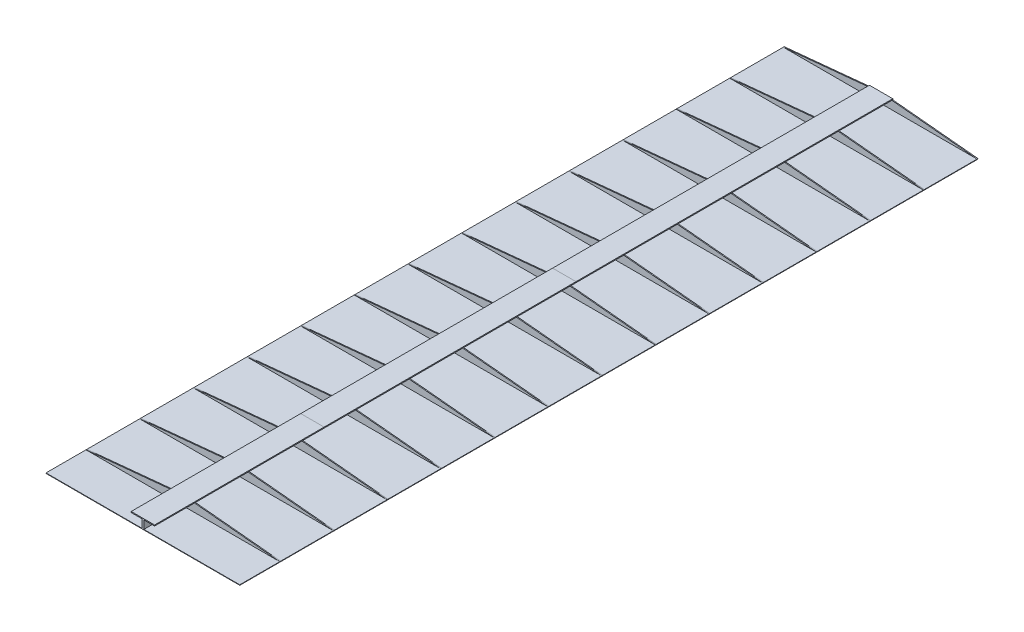
from build123d import *

# Parameters (mm, degrees)
BOSS_EXTRUDE1_DEPTH   = 7620
SKETCH7_W             = 110.65
SKETCH7_H             = 85
CUT_EXTRUDE3_DEPTH    = 7690.971678914
BOSS_EXTRUDE3_DEPTH   = 9.525
LPATTERN2_COUNT       = 14
LPATTERN2_PITCH       = 553.68
MIRROR2_COPY_1_DEPTH  = 9.525
MIRROR2_COPY_2_DEPTH  = 9.525
MIRROR2_COPY_3_DEPTH  = 9.525
MIRROR2_COPY_4_DEPTH  = 9.525
MIRROR2_COPY_5_DEPTH  = 9.525
MIRROR2_COPY_6_DEPTH  = 9.525
MIRROR2_COPY_7_DEPTH  = 9.525
MIRROR2_COPY_8_DEPTH  = 9.525
MIRROR2_COPY_9_DEPTH  = 9.525
MIRROR2_COPY_10_DEPTH = 9.525
MIRROR2_COPY_11_DEPTH = 9.525
MIRROR2_COPY_12_DEPTH = 9.525
MIRROR2_COPY_13_DEPTH = 9.525


with BuildPart() as part:
    # Sketch1 → Boss-Extrude1 (new body)
    with BuildSketch(Plane.XY):
        Polygon((-90, 95), (151.3, 95), (151.3, 0), (1030.65, 0), (1030.65, -5), (-969.35, -5), (-969.35, 0), (-90, 0), align=None)
    extrude(amount=-BOSS_EXTRUDE1_DEPTH)

    # Sketch7 → Cut-Extrude3 (cut, through all)
    with BuildSketch(Plane(origin=(0, 0, -7620), x_dir=(-1, 0, 0), z_dir=(0, 0, -1))):
        with Locations((-95.975, 42.5)):
            Rectangle(SKETCH7_W, SKETCH7_H)
        with Locations((34.675, 42.5)):
            Rectangle(SKETCH7_W, SKETCH7_H)
    extrude(amount=-CUT_EXTRUDE3_DEPTH, mode=Mode.SUBTRACT)

    # Sketch8 → Boss-Extrude3 (add)
    with BuildSketch(Plane(origin=(0, 0, -7620), x_dir=(-1, 0, 0), z_dir=(0, 0, -1))):
        Polygon((-40.65, 0), (-40.65, 85), (-151.3, 85), (-1030.65, 0), align=None)
    boss_extrude3 = extrude(amount=-BOSS_EXTRUDE3_DEPTH)

    # LPattern2: Boss-Extrude3 ×14
    with Locations(*[(0, 0, i * LPATTERN2_PITCH) for i in range(1, LPATTERN2_COUNT)]):
        add(boss_extrude3)

    # Mirror2: Boss-Extrude3 across plane
    add(boss_extrude3.mirror(Plane(origin=(30.65, 0, 0), x_dir=(0, 0, 1), z_dir=(1, 0, 0))))

    # Mirror2 copy 1 sketch → Mirror2 copy 1 (add)
    with BuildSketch(Plane(origin=(61.3, 0, -7066.32), x_dir=(1, 0, 0), z_dir=(0, 0, -1))):
        Polygon((-40.65, 0), (-40.65, -85), (-151.3, -85), (-1030.65, 0), align=None)
    extrude(amount=-MIRROR2_COPY_1_DEPTH)

    # Mirror2 copy 2 sketch → Mirror2 copy 2 (add)
    with BuildSketch(Plane(origin=(61.3, 0, -6512.64), x_dir=(1, 0, 0), z_dir=(0, 0, -1))):
        Polygon((-40.65, 0), (-40.65, -85), (-151.3, -85), (-1030.65, 0), align=None)
    extrude(amount=-MIRROR2_COPY_2_DEPTH)

    # Mirror2 copy 3 sketch → Mirror2 copy 3 (add)
    with BuildSketch(Plane(origin=(61.3, 0, -5958.96), x_dir=(1, 0, 0), z_dir=(0, 0, -1))):
        Polygon((-40.65, 0), (-40.65, -85), (-151.3, -85), (-1030.65, 0), align=None)
    extrude(amount=-MIRROR2_COPY_3_DEPTH)

    # Mirror2 copy 4 sketch → Mirror2 copy 4 (add)
    with BuildSketch(Plane(origin=(61.3, 0, -5405.28), x_dir=(1, 0, 0), z_dir=(0, 0, -1))):
        Polygon((-40.65, 0), (-40.65, -85), (-151.3, -85), (-1030.65, 0), align=None)
    extrude(amount=-MIRROR2_COPY_4_DEPTH)

    # Mirror2 copy 5 sketch → Mirror2 copy 5 (add)
    with BuildSketch(Plane(origin=(61.3, 0, -4851.6), x_dir=(1, 0, 0), z_dir=(0, 0, -1))):
        Polygon((-40.65, 0), (-40.65, -85), (-151.3, -85), (-1030.65, 0), align=None)
    extrude(amount=-MIRROR2_COPY_5_DEPTH)

    # Mirror2 copy 6 sketch → Mirror2 copy 6 (add)
    with BuildSketch(Plane(origin=(61.3, 0, -4297.92), x_dir=(1, 0, 0), z_dir=(0, 0, -1))):
        Polygon((-40.65, 0), (-40.65, -85), (-151.3, -85), (-1030.65, 0), align=None)
    extrude(amount=-MIRROR2_COPY_6_DEPTH)

    # Mirror2 copy 7 sketch → Mirror2 copy 7 (add)
    with BuildSketch(Plane(origin=(61.3, 0, -3744.24), x_dir=(1, 0, 0), z_dir=(0, 0, -1))):
        Polygon((-40.65, 0), (-40.65, -85), (-151.3, -85), (-1030.65, 0), align=None)
    extrude(amount=-MIRROR2_COPY_7_DEPTH)

    # Mirror2 copy 8 sketch → Mirror2 copy 8 (add)
    with BuildSketch(Plane(origin=(61.3, 0, -3190.56), x_dir=(1, 0, 0), z_dir=(0, 0, -1))):
        Polygon((-40.65, 0), (-40.65, -85), (-151.3, -85), (-1030.65, 0), align=None)
    extrude(amount=-MIRROR2_COPY_8_DEPTH)

    # Mirror2 copy 9 sketch → Mirror2 copy 9 (add)
    with BuildSketch(Plane(origin=(61.3, 0, -2636.88), x_dir=(1, 0, 0), z_dir=(0, 0, -1))):
        Polygon((-40.65, 0), (-40.65, -85), (-151.3, -85), (-1030.65, 0), align=None)
    extrude(amount=-MIRROR2_COPY_9_DEPTH)

    # Mirror2 copy 10 sketch → Mirror2 copy 10 (add)
    with BuildSketch(Plane(origin=(61.3, 0, -2083.2), x_dir=(1, 0, 0), z_dir=(0, 0, -1))):
        Polygon((-40.65, 0), (-40.65, -85), (-151.3, -85), (-1030.65, 0), align=None)
    extrude(amount=-MIRROR2_COPY_10_DEPTH)

    # Mirror2 copy 11 sketch → Mirror2 copy 11 (add)
    with BuildSketch(Plane(origin=(61.3, 0, -1529.52), x_dir=(1, 0, 0), z_dir=(0, 0, -1))):
        Polygon((-40.65, 0), (-40.65, -85), (-151.3, -85), (-1030.65, 0), align=None)
    extrude(amount=-MIRROR2_COPY_11_DEPTH)

    # Mirror2 copy 12 sketch → Mirror2 copy 12 (add)
    with BuildSketch(Plane(origin=(61.3, 0, -975.84), x_dir=(1, 0, 0), z_dir=(0, 0, -1))):
        Polygon((-40.65, 0), (-40.65, -85), (-151.3, -85), (-1030.65, 0), align=None)
    extrude(amount=-MIRROR2_COPY_12_DEPTH)

    # Mirror2 copy 13 sketch → Mirror2 copy 13 (add)
    with BuildSketch(Plane(origin=(61.3, 0, -422.16), x_dir=(1, 0, 0), z_dir=(0, 0, -1))):
        Polygon((-40.65, 0), (-40.65, -85), (-151.3, -85), (-1030.65, 0), align=None)
    extrude(amount=-MIRROR2_COPY_13_DEPTH)


solid = part.part
